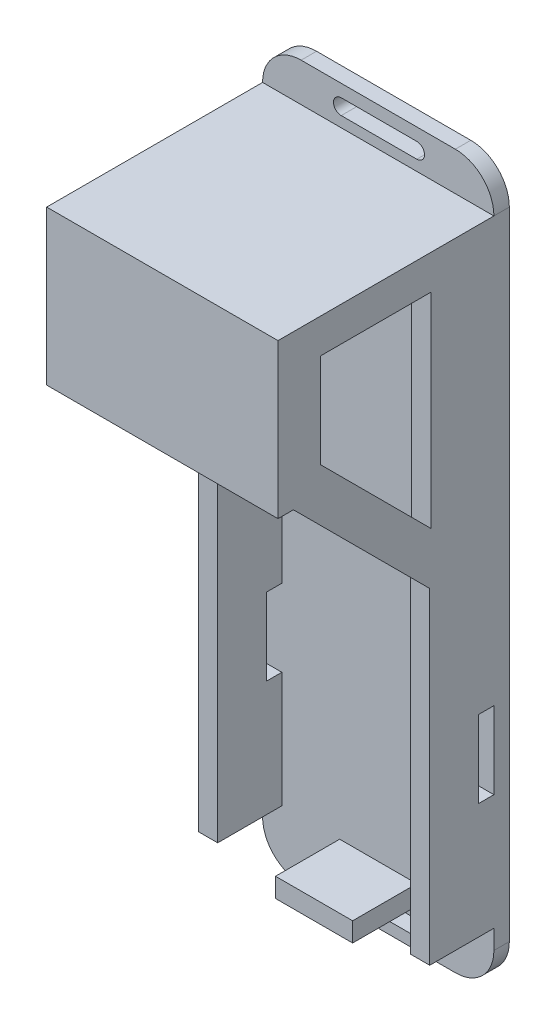
from build123d import *

# Parameters (mm, degrees)
SALIENTE_EXTRUIR2_DEPTH    = 4
SALIENTE_EXTRUIR3_DEPTH    = 52
CROQUIS3_W                 = 60
CROQUIS3_H                 = 4
SALIENTE_EXTRUIR4_DEPTH    = 40
CORTAR_EXTRUIR1_DEPTH      = 87
CORTAR_EXTRUIR2_DEPTH      = 87
CORTAR_EXTRUIR2_DEPTH_BACK = 87
CROQUIS6_W                 = 4
CROQUIS6_H                 = 20
CORTAR_EXTRUIR3_DEPTH      = 87
CORTAR_EXTRUIR4_DEPTH      = 87


with BuildPart() as part:
    # Croquis1 → Saliente-Extruir2 (new body)
    with BuildSketch(Plane.XY):
        with BuildLine():
            ThreePointArc((-30, 82.5), (-27.071067812, 89.571067812), (-20, 92.5))
            Line((-20, 92.5), (20, 92.5))
            ThreePointArc((20, 92.5), (27.071067812, 89.571067812), (30, 82.5))
            Line((30, 82.5), (-30, 82.5))
        make_face()
        Polygon((25, 77.5), (25, -77.5), (30, -77.5), (30, 82.5), (-30, 82.5), (-30, -77.5), (-25, -77.5), (-25, 77.5), align=None)
        Polygon((-10, -77.5), (0, -77.5), (10, -77.5), (25, -77.5), (25, 77.5), (-25, 77.5), (-25, -77.5), align=None)
        with BuildLine():
            Line((25, -77.5), (10, -77.5))
            Line((10, -77.5), (10, -82.5))
            Line((10, -82.5), (-10, -82.5))
            Line((-10, -82.5), (-10, -77.5))
            Line((-10, -77.5), (-25, -77.5))
            Line((-25, -77.5), (-30, -77.5))
            Line((-30, -77.5), (-30, -82.5))
            ThreePointArc((-30, -82.5), (-27.071067812, -89.571067812), (-20, -92.5))
            Line((-20, -92.5), (20, -92.5))
            ThreePointArc((20, -92.5), (27.071067812, -89.571067812), (30, -82.5))
            Line((30, -82.5), (30, -77.5))
            Line((30, -77.5), (25, -77.5))
        make_face()
        Polygon((10, -77.5), (0, -77.5), (-10, -77.5), (-10, -82.5), (10, -82.5), align=None)
    extrude(amount=SALIENTE_EXTRUIR2_DEPTH)

    # Croquis2 → Saliente-Extruir3 (add)
    with BuildSketch(Plane.XY.offset(4)):
        Polygon((10, -77.5), (0, -77.5), (-10, -77.5), (-10, -82.5), (10, -82.5), align=None)
        Polygon((25, 77.5), (25, -77.5), (30, -77.5), (30, 82.5), (-30, 82.5), (-30, -77.5), (-25, -77.5), (-25, 77.5), align=None)
    extrude(amount=SALIENTE_EXTRUIR3_DEPTH)

    # Croquis3 → Saliente-Extruir4 (add)
    with BuildSketch(Plane(origin=(0, 82.5, 0), x_dir=(1, 0, 0), z_dir=(0, 1, 0))):
        with Locations((0, -58)):
            Rectangle(CROQUIS3_W, CROQUIS3_H)
    extrude(amount=-SALIENTE_EXTRUIR4_DEPTH)

    # Croquis4 → Cortar-Extruir1 (cut)
    with BuildSketch(Plane.ZY.offset(30)):
        Polygon((56, 42.5), (20.644660941, 7.144660941), (20.644660941, -100.088523904), (56, -100.088523904), align=None)
    extrude(amount=-CORTAR_EXTRUIR1_DEPTH, mode=Mode.SUBTRACT)

    # Croquis6 → Cortar-Extruir2 (cut, two sides: drawn at the far end of the back side and taken through both)
    with BuildSketch(Plane.ZY.offset(-25).offset(-CORTAR_EXTRUIR2_DEPTH_BACK)):
        with Locations((6, -37.5)):
            Rectangle(CROQUIS6_W, CROQUIS6_H)
    extrude(amount=CORTAR_EXTRUIR2_DEPTH + CORTAR_EXTRUIR2_DEPTH_BACK, mode=Mode.SUBTRACT)

    # Croquis7 → Cortar-Extruir3 (cut)
    with BuildSketch(Plane.ZY.offset(30)):
        Polygon((20.325435978, 20.468039644), (20.325435978, 73.545906874), (48.990760507, 73.545906874), (48.990760507, 49.133364172), align=None)
    extrude(amount=-CORTAR_EXTRUIR3_DEPTH, mode=Mode.SUBTRACT)

    # Croquis8 → Cortar-Extruir4 (cut)
    with BuildSketch(Plane.XY.offset(4)):
        with BuildLine():
            Line((-9.602247867, -85.5), (10, -85.5))
            ThreePointArc((10, -85.5), (12, -87.5), (10, -89.5))
            Line((10, -89.5), (-9.602247867, -89.5))
            ThreePointArc((-9.602247867, -89.5), (-11.602247867, -87.5), (-9.602247867, -85.5))
        make_face()
        with BuildLine():
            Line((10, 85.25), (-9.602247867, 85.25))
            ThreePointArc((-9.602247867, 85.25), (-11.602247867, 87.25), (-9.602247867, 89.25))
            Line((-9.602247867, 89.25), (10, 89.25))
            ThreePointArc((10, 89.25), (12, 87.25), (10, 85.25))
        make_face()
    extrude(amount=-CORTAR_EXTRUIR4_DEPTH, mode=Mode.SUBTRACT)


solid = part.part
